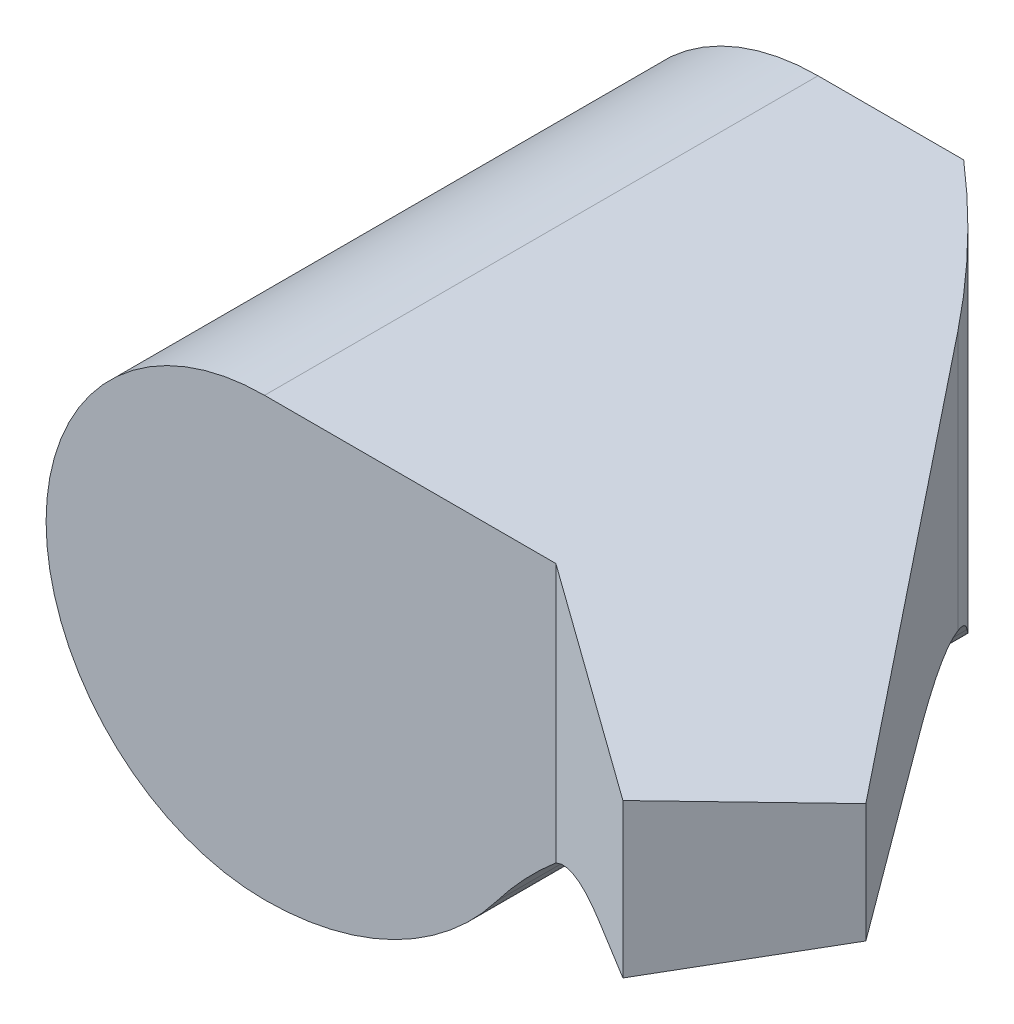
from build123d import *

# Parameters (mm, degrees)
BOSS_EXTRUDE1_DEPTH = 38
BOSS_EXTRUDE3_DEPTH = 30
CUT_EXTRUDE2_DEPTH  = 61
CUT_EXTRUDE1_DEPTH  = 61


with BuildPart() as part:
    # Sketch1 → Boss-Extrude1 (new body)
    with BuildSketch(Plane.XY):
        with BuildLine():
            Line((-16.024694199, 26.673676157), (3.975305801, 26.673676157))
            Line((3.975305801, 26.673676157), (3.975305801, -3.326323843))
            Line((3.975305801, -3.326323843), (-16.024694199, -3.326323843))
            ThreePointArc((-16.024694199, -3.326323843), (-31.024694199, 11.673676157), (-16.024694199, 26.673676157))
        make_face()
    extrude(amount=BOSS_EXTRUDE1_DEPTH)

    # Sketch2 → Boss-Extrude3 (add)
    with BuildSketch(Plane.XZ.offset(3.326323843)):
        Polygon((3.975305801, 38), (3.975305801, 10.402664479), (28.894576723, 41.635004813), (20.3703899, 49.791936592), align=None)
    extrude(amount=-BOSS_EXTRUDE3_DEPTH)

    # Sketch4 → Cut-Extrude2 (cut)
    with BuildSketch(Plane.XZ.offset(3.326323843)):
        with BuildLine():
            Line((-6.024694199, 0), (8.586429147, -30.750559355))
            Line((8.586429147, -30.750559355), (53.639483602, 0))
            Line((53.639483602, 0), (3.975305801, 10.402664479))
            ThreePointArc((3.975305801, 10.402664479), (-0.784676233, 4.970604847), (-6.024694199, 0))
        make_face()
    extrude(amount=-CUT_EXTRUDE2_DEPTH, mode=Mode.SUBTRACT)

    # Sketch3 → Cut-Extrude1 (cut)
    with BuildSketch(Plane(origin=(0, 0, 0), x_dir=(-1, 0, 0), z_dir=(0, 0, -1))):
        with BuildLine():
            Line((-14.471237169, 14.471119338), (-28.894576723, 18.506537052))
            Line((-28.894576723, 18.506537052), (-57.421554234, 26.725830047))
            Line((-57.421554234, 26.725830047), (-3.301256906, -44.718260526))
            Line((-3.301256906, -44.718260526), (16.024694199, -3.326323843))
            ThreePointArc((16.024694199, -3.326323843), (7.12126065, -1.239294), (0.072764407, 4.586984677))
            ThreePointArc((0.072764407, 4.586984677), (-6.391299116, 10.717890613), (-14.471237169, 14.471119338))
        make_face()
    extrude(amount=-CUT_EXTRUDE1_DEPTH, mode=Mode.SUBTRACT)


solid = part.part
